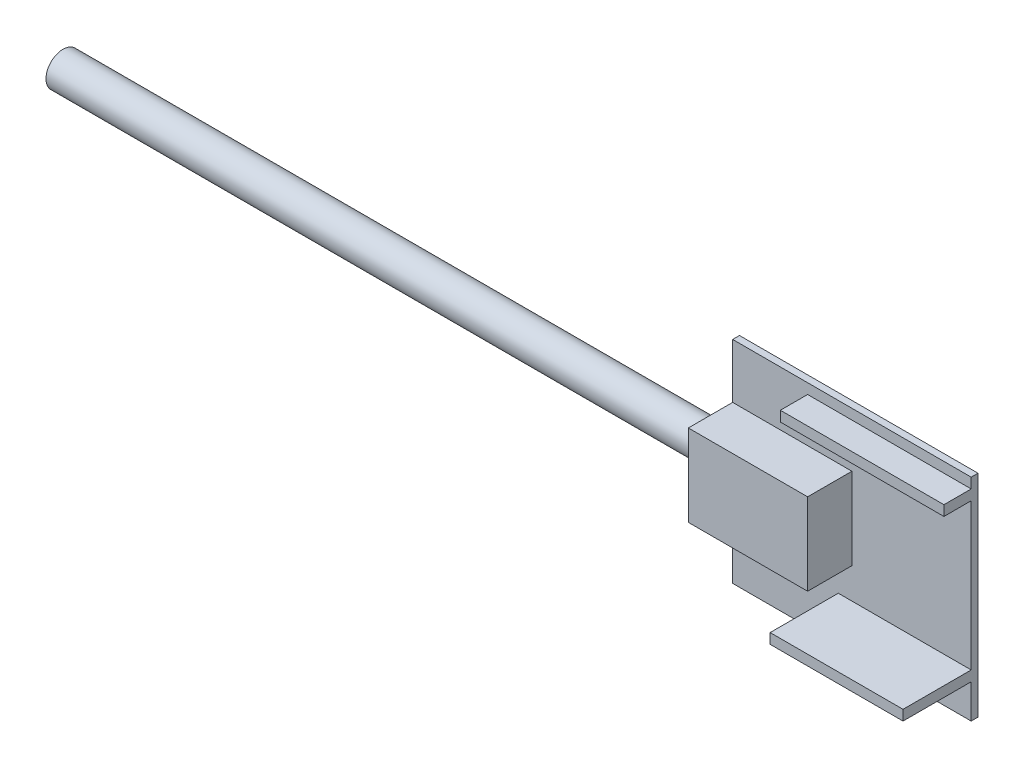
from build123d import *

# Parameters (mm, degrees)
ESQUISSE1_W        = 70
ESQUISSE1_H        = 62
BOSS_EXTRU_1_DEPTH = 2
ESQUISSE2_W        = 35
ESQUISSE2_H        = 24
BOSS_EXTRU_2_DEPTH = 15
ESQUISSE3_W        = 39
ESQUISSE3_H        = 3
BOSS_EXTRU_3_DEPTH = 22
ESQUISSE4_W        = 48
ESQUISSE4_H        = 3
BOSS_EXTRU_4_DEPTH = 10
ESQUISSE5_R        = 5
BOSS_EXTRU_5_DEPTH = 190


with BuildPart() as part:
    # Esquisse1 → Boss.-Extru.1 (new body)
    with BuildSketch(Plane.XY):
        Rectangle(ESQUISSE1_W, ESQUISSE1_H)
    extrude(amount=BOSS_EXTRU_1_DEPTH)

    # Esquisse2 → Boss.-Extru.2 (add)
    with BuildSketch(Plane.XY):
        with Locations((-17.5, 3)):
            Rectangle(ESQUISSE2_W, ESQUISSE2_H)
    extrude(amount=BOSS_EXTRU_2_DEPTH)

    # Esquisse3 → Boss.-Extru.3 (add)
    with BuildSketch(Plane.XY):
        with Locations((15.5, -19.5)):
            Rectangle(ESQUISSE3_W, ESQUISSE3_H)
    extrude(amount=BOSS_EXTRU_3_DEPTH)

    # Esquisse4 → Boss.-Extru.4 (add)
    with BuildSketch(Plane.XY):
        with Locations((11, 26.5)):
            Rectangle(ESQUISSE4_W, ESQUISSE4_H)
    extrude(amount=BOSS_EXTRU_4_DEPTH)

    # Esquisse5 → Boss.-Extru.5 (add)
    with BuildSketch(Plane.ZY.offset(35)):
        with Locations(Location((8.5, 8, 0), (0, 0, 90))):
            Circle(ESQUISSE5_R)
    extrude(amount=BOSS_EXTRU_5_DEPTH)


solid = part.part
